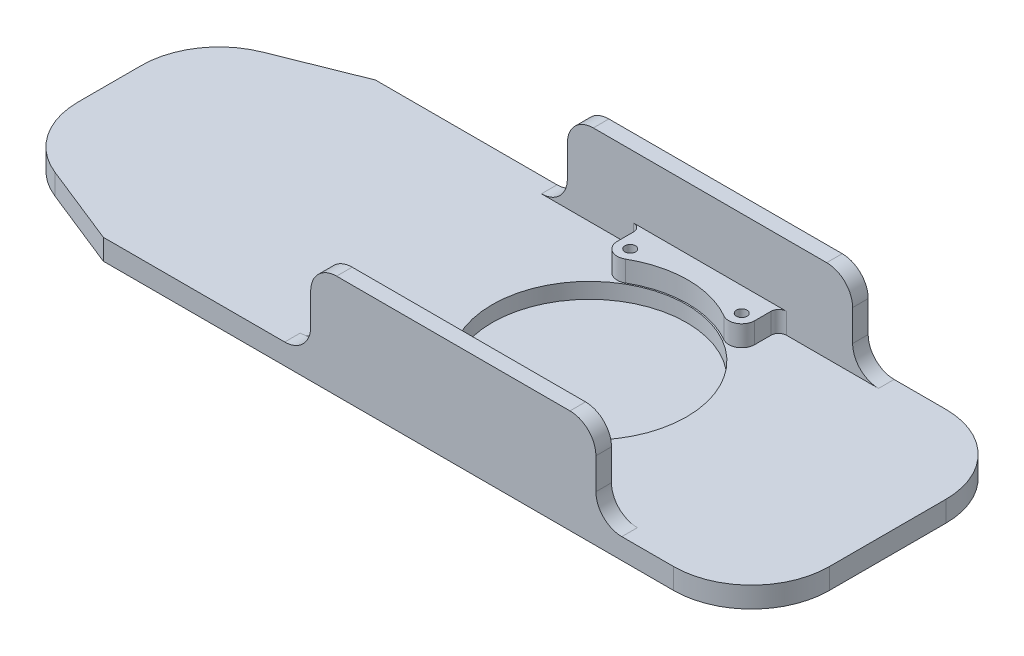
from build123d import *

# Parameters (mm, degrees)
EXTRUDE_1_DEPTH        = 52.5
SKETCH_3_W             = 60
SKETCH_3_H             = 105
CUT_EXTRUDE_1_DEPTH    = 32
SKETCH_4_W             = 54
SKETCH_4_H             = 71
SKETCH_4_R             = 9.5
EXTRUDE_3_DEPTH        = 22.5
SKETCH_4_3_W           = 54
SKETCH_4_3_H           = 71
SKETCH_4_3_R           = 9.5
CUT_EXTRUDE_2_DEPTH    = 14.5
SKETCH_5_R             = 9.5
SKETCH_5_R_2           = 8
EXTRUDE_4_DEPTH        = 2
EXTRUDE_START          = -2
SKETCH_6_R             = 9.5
SKETCH_6_R_2           = 8
EXTRUDE_5_DEPTH        = 2
FILLET_1_R             = 14
FILLET_1_OF_MIRROR_2_R = 14
SKETCH_8_W             = 95
SKETCH_8_H             = 78.931088685
CUT_EXTRUDE_4_DEPTH    = 130
SKETCH_10_W            = 100
SKETCH_10_H            = 93
CUT_EXTRUDE_6_DEPTH    = 32
CUT_EXTRUDE_7_DEPTH    = 73
SKETCH_12_W            = 19.42301832
SKETCH_12_H            = 121.860085881
CUT_EXTRUDE_8_DEPTH    = 73
CUT_EXTRUDE_10_DEPTH   = 150
SKETCH_15_R            = 2.05
SKETCH_15_R_2          = 37.5
CUT_EXTRUDE_11_DEPTH   = 313.725518626
SKETCH_18_W            = 61.222247188
SKETCH_18_H            = 97.808163194
CUT_EXTRUDE_13_DEPTH   = 170
SKETCH_19_R            = 37.5
EXTRUDE_6_DEPTH        = 2
FILLET_2_R             = 30
SKETCH_21_W            = 132.10932858
SKETCH_21_H            = 125.518868867
CUT_EXTRUDE_15_DEPTH   = 149
MM_1_D                 = 10
MM_1_DEPTH             = 4
MM_1_TIP               = 3.004303095
SKETCH_23_W            = 93
SKETCH_23_H            = 32
CUT_EXTRUDE_16_DEPTH   = 149
FILLET_3_R             = 10
EXTRUDE_START_2        = 8
EXTRUDE_8_DEPTH        = 8
CUT_EXTRUDE_START      = -47
SKETCH_27_R            = 2.05
CUT_EXTRUDE_18_DEPTH   = 47
FILLET_4_R             = 3


with BuildPart() as part:
    # 草图1 → 凸台-拉伸1 (new, symmetric)
    with BuildSketch(Plane.XY):
        Polygon((0, 0), (300, 0), (300, 40), (130, 40), (0, 8), align=None)
    extrude(amount=EXTRUDE_1_DEPTH, both=True)

    # 草图3 → 切除-拉伸1 (cut)
    with BuildSketch(Plane(origin=(0, 40, 0), x_dir=(1, 0, 0), z_dir=(0, 1, 0))):
        with Locations((270, 0)):
            Rectangle(SKETCH_3_W, SKETCH_3_H)
    extrude(amount=-CUT_EXTRUDE_1_DEPTH, mode=Mode.SUBTRACT)

    # 草图4 → 凸台-拉伸3 (add, symmetric)
    with BuildSketch(Plane.XY.offset(30)):
        with Locations((273, 43.5)):
            Rectangle(SKETCH_4_W, SKETCH_4_H)
        with Locations(Location((260, 65, 0), (0, 0, 180))):
            Circle(SKETCH_4_R, mode=Mode.SUBTRACT)
    extrude_3 = extrude(amount=EXTRUDE_3_DEPTH, both=True)

    # 草图4<3> → 切除-拉伸2 (cut, symmetric)
    with BuildSketch(Plane.XY.offset(30)):
        with Locations((273, 43.5)):
            Rectangle(SKETCH_4_3_W, SKETCH_4_3_H)
        with Locations(Location((260, 65, 0), (0, 0, 180))):
            Circle(SKETCH_4_3_R, mode=Mode.SUBTRACT)
    cut_extrude_2 = extrude(amount=CUT_EXTRUDE_2_DEPTH, both=True, mode=Mode.SUBTRACT)

    # 草图5 → 凸台-拉伸4 (add)
    with BuildSketch(Plane(origin=(0, 0, 44.5), x_dir=(-1, 0, 0), z_dir=(0, 0, -1))):
        with Locations((-260, 65)):
            Circle(SKETCH_5_R)
        with Locations((-260, 65)):
            Circle(SKETCH_5_R_2, mode=Mode.SUBTRACT)
    extrude_4 = extrude(amount=-EXTRUDE_4_DEPTH)

    # 草图6 → 凸台-拉伸5 (add)
    with BuildSketch(Plane.XY.offset(15.5).offset(EXTRUDE_START)):
        with Locations(Location((260, 65, 0), (0, 0, 180))):
            Circle(SKETCH_6_R)
        with Locations(Location((260, 65, 0), (0, 0, 180))):
            Circle(SKETCH_6_R_2, mode=Mode.SUBTRACT)
    extrude_5 = extrude(amount=EXTRUDE_5_DEPTH)

    # 圆角1
    fillet_1_edges = [part.edges().sort_by_distance(p)[0] for p in [
        (246, 79, 48.5),
        (246, 79, 11.5),
    ]]
    fillet(fillet_1_edges, radius=FILLET_1_R)

    # 镜向2: 凸台-拉伸3, 切除-拉伸2, 凸台-拉伸4, 凸台-拉伸5 across plane
    add(extrude_3.mirror(Plane.XY))
    add(cut_extrude_2.mirror(Plane.XY), mode=Mode.SUBTRACT)
    add(extrude_4.mirror(Plane.XY))
    add(extrude_5.mirror(Plane.XY))

    # 圆角1 of 镜向2
    fillet_1_of_mirror_2_edges = [part.edges().sort_by_distance(p)[0] for p in [
        (246, 79, -48.5),
        (246, 79, -11.5),
    ]]
    fillet(fillet_1_of_mirror_2_edges, radius=FILLET_1_OF_MIRROR_2_R)

    # 草图8 → 切除-拉伸4 (cut)
    with BuildSketch(Plane.ZY):
        with Locations((0, 47.465544343)):
            Rectangle(SKETCH_8_W, SKETCH_8_H)
    extrude(amount=-CUT_EXTRUDE_4_DEPTH, mode=Mode.SUBTRACT)

    # 草图10 → 切除-拉伸6 (cut)
    with BuildSketch(Plane(origin=(0, 40, 0), x_dir=(1, 0, 0), z_dir=(0, 1, 0))):
        with Locations((185, 0)):
            Rectangle(SKETCH_10_W, SKETCH_10_H)
    extrude(amount=-CUT_EXTRUDE_6_DEPTH, mode=Mode.SUBTRACT)

    # 草图11 → 切除-拉伸7 (cut)
    with BuildSketch(Plane.XZ):
        Polygon((-14.613233699, 52.5), (50.030946001, 52.5), (0, 32.5), (0, -32.5), (50, -52.5), (-14.613233699, -52.5), align=None)
    extrude(amount=-CUT_EXTRUDE_7_DEPTH, mode=Mode.SUBTRACT)

    # 草图12 → 切除-拉伸8 (cut)
    with BuildSketch(Plane(origin=(0, 8, 0), x_dir=(1, 0, 0), z_dir=(0, 1, 0))):
        with Locations((40.28849084, -8.430042941)):
            Rectangle(SKETCH_12_W, SKETCH_12_H)
    extrude(amount=CUT_EXTRUDE_8_DEPTH, mode=Mode.SUBTRACT)

    # 草图14 → 切除-拉伸10 (cut, symmetric)
    with BuildSketch(Plane.XY.offset(52.5)):
        with BuildLine():
            Line((275.075376069, 79), (318.037843951, 79))
            Line((318.037843951, 79), (300, 8))
            ThreePointArc((300, 8), (292.070381124, 45.091206629), (275.075376069, 79))
        make_face()
    extrude(amount=CUT_EXTRUDE_10_DEPTH, both=True, mode=Mode.SUBTRACT)

    # 草图15 → 切除-拉伸11 (cut, through all)
    with BuildSketch(Plane(origin=(0, 8, 0), x_dir=(1, 0, 0), z_dir=(0, 1, 0))):
        with Locations(Location((163.5, -37.239092363, 0), (0, 0, 180))):
            Circle(SKETCH_15_R)
        with Locations((163.5, 37.239092363)):
            Circle(SKETCH_15_R)
        with Locations(Location((206.5, 37.239092363, 0), (0, 0, 180))):
            Circle(SKETCH_15_R)
        with Locations((206.5, -37.239092363)):
            Circle(SKETCH_15_R)
        with Locations(Location((185, 0, 0), (0, 0, 180))):
            Circle(SKETCH_15_R_2)
    extrude(amount=-CUT_EXTRUDE_11_DEPTH, mode=Mode.SUBTRACT)

    # 草图18 → 切除-拉伸13 (cut)
    with BuildSketch(Plane.XY.offset(52.5)):
        with Locations((276.611123594, 56.904081597)):
            Rectangle(SKETCH_18_W, SKETCH_18_H)
    extrude(amount=-CUT_EXTRUDE_13_DEPTH, mode=Mode.SUBTRACT)

    # 草图19 → 凸台-拉伸6 (add)
    with BuildSketch(Plane.XZ.offset(EXTRUDE_START)):
        with Locations(Location((185, 0, 0), (0, 0, 180))):
            Circle(SKETCH_19_R)
    extrude(amount=EXTRUDE_6_DEPTH)

    # 圆角2
    fillet_2_edges = [part.edges().sort_by_distance(p)[0] for p in [
        (300, 4, 52.5),
        (0, 4, 32.5),
        (0, 4, -32.5),
        (300, 4, -52.5),
    ]]
    fillet(fillet_2_edges, radius=FILLET_2_R)

    # 草图21 → 切除-拉伸15 (cut)
    with BuildSketch(Plane(origin=(0, 8, 0), x_dir=(1, 0, 0), z_dir=(0, 1, 0))):
        with Locations((63.94533571, -10.259434434)):
            Rectangle(SKETCH_21_W, SKETCH_21_H)
    extrude(amount=CUT_EXTRUDE_15_DEPTH, mode=Mode.SUBTRACT)

    # 大小mm 暗销孔1
    with Locations(Plane(origin=(163.5, 0, 37.239092363), x_dir=(0, 0, -1), z_dir=(0, -1, 0))):
        with Locations((0, 0), (0, 43), (74.478184726, 43), (74.478184726, 0)):
            Hole(MM_1_D / 2, depth=MM_1_DEPTH)
            with Locations((0, 0, -(MM_1_DEPTH + MM_1_TIP / 2))):  # 118° drill point
                Cone(0, MM_1_D / 2, MM_1_TIP, mode=Mode.SUBTRACT)

    # 草图23 → 切除-拉伸16 (cut)
    with BuildSketch(Plane.ZY.offset(-130)):
        with Locations((0, 24)):
            Rectangle(SKETCH_23_W, SKETCH_23_H)
    extrude(amount=-CUT_EXTRUDE_16_DEPTH, mode=Mode.SUBTRACT)

    # 圆角3
    fillet_3_edges = [part.edges().sort_by_distance(p)[0] for p in [
        (130, 8, -49.5),
        (240, 40, -49.5),
        (240, 8, 49.5),
        (130, 8, 49.5),
        (130, 40, -49.5),
        (240, 8, -49.5),
        (240, 40, 49.5),
        (130, 40, 49.5),
    ]]
    fillet(fillet_3_edges, radius=FILLET_3_R)

    # 草图26 → 凸台-拉伸8 (add)
    with BuildSketch(Plane(origin=(0, 8, 0), x_dir=(1, 0, 0), z_dir=(0, 1, 0)).offset(EXTRUDE_START_2)):
        with BuildLine():
            Line((158.5, 46.5), (158.5, 37.239092363))
            ThreePointArc((158.5, 37.239092363), (161, 32.908965344), (166, 32.908965344))
            ThreePointArc((166, 32.908965344), (185, 38), (204, 32.908965344))
            ThreePointArc((204, 32.908965344), (209, 32.908965344), (211.5, 37.239092363))
            Line((211.5, 37.239092363), (211.5, 46.5))
            Line((211.5, 46.5), (211.5, 50.5))
            Line((211.5, 50.5), (158.5, 50.5))
            Line((158.5, 50.5), (158.5, 46.5))
        make_face()
        with BuildLine():
            Line((211.5, -46.495333446), (211.5, -37.234425809))
            ThreePointArc((211.5, -37.234425809), (209, -32.90429879), (204, -32.90429879))
            ThreePointArc((204, -32.90429879), (185, -37.995333446), (166, -32.90429879))
            ThreePointArc((166, -32.90429879), (161, -32.90429879), (158.5, -37.234425809))
            Line((158.5, -37.234425809), (158.5, -46.495333446))
            Line((158.5, -46.495333446), (158.5, -50.495333446))
            Line((158.5, -50.495333446), (211.5, -50.495333446))
            Line((211.5, -50.495333446), (211.5, -46.495333446))
        make_face()
    extrude(amount=-EXTRUDE_8_DEPTH)

    # 草图27 → 切除-拉伸18 (cut)
    with BuildSketch(Plane.XZ.offset(CUT_EXTRUDE_START)):
        with Locations(Location((206.5, -37.239092363, 0), (0, 0, 270))):
            Circle(SKETCH_27_R)
        with Locations(Location((163.5, -37.239092363, 0), (0, 0, 270))):
            Circle(SKETCH_27_R)
        with Locations(Location((163.5, 37.239092363, 0), (0, 0, 90))):
            Circle(SKETCH_27_R)
        with Locations(Location((206.5, 37.239092363, 0), (0, 0, 90))):
            Circle(SKETCH_27_R)
    extrude(amount=CUT_EXTRUDE_18_DEPTH, mode=Mode.SUBTRACT)

    # 圆角4
    fillet_4_edges = [part.edges().sort_by_distance(p)[0] for p in [
        (211.5, 12, -46.5),
        (158.5, 12, -46.5),
        (211.5, 12, 46.5),
        (158.5, 12, 46.5),
    ]]
    fillet(fillet_4_edges, radius=FILLET_4_R)


solid = part.part
